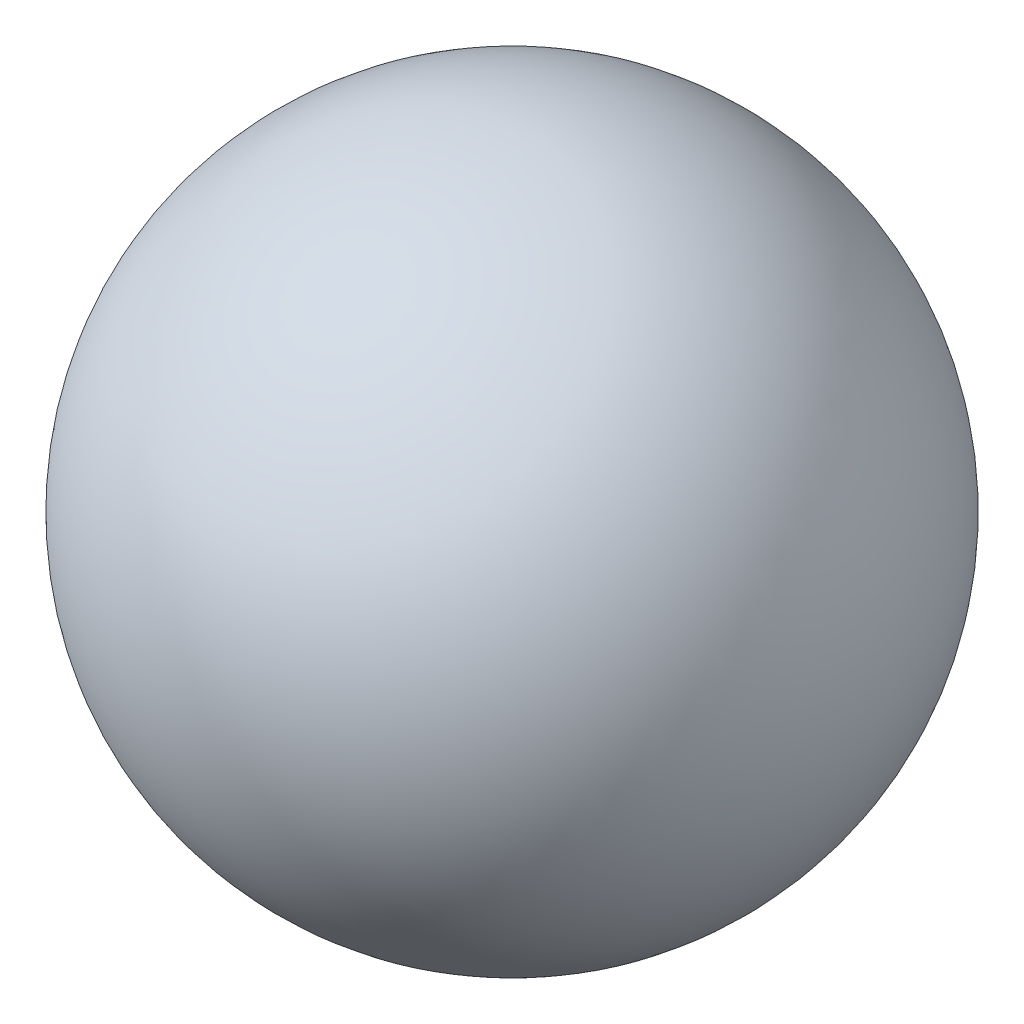
from build123d import *


with BuildPart() as part:
    # Sketch7 → Revolve1 (revolve)
    with BuildSketch(Plane.XY):
        with BuildLine():
            Line((0, 6.35), (0, -6.35))
            ThreePointArc((0, -6.35), (6.35, 0), (0, 6.35))
        make_face()
    revolve(axis=Axis((0, 6.35, 0), (0, -1, 0)))


solid = part.part
